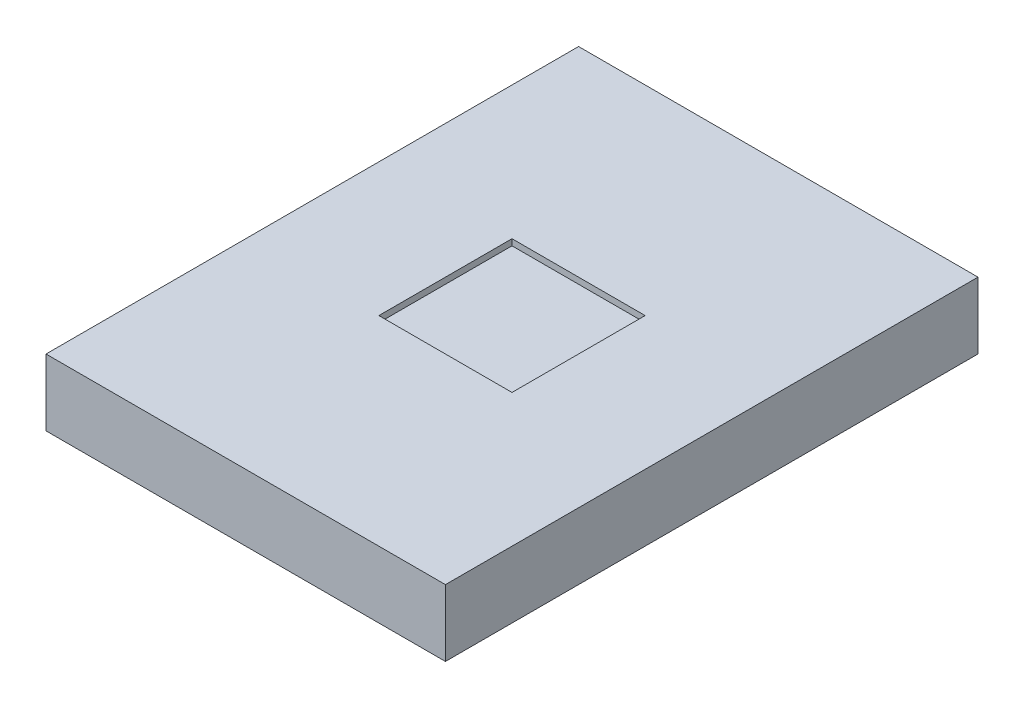
from build123d import *

# Parameters (mm, degrees)
SKETCH1_W           = 30
SKETCH1_H           = 40
BOSS_EXTRUDE1_DEPTH = 5
SKETCH2_W           = 10
SKETCH2_H           = 10
CUT_EXTRUDE1_DEPTH  = 0.465


with BuildPart() as part:
    # Sketch1 → Boss-Extrude1 (new body)
    with BuildSketch(Plane(origin=(0, 0, 0), x_dir=(1, 0, 0), z_dir=(0, 1, 0))):
        with Locations((-1.009379029, 0.27528519)):
            Rectangle(SKETCH1_W, SKETCH1_H)
    extrude(amount=BOSS_EXTRUDE1_DEPTH)

    # Sketch2 → Cut-Extrude1 (cut)
    with BuildSketch(Plane(origin=(0, 5, 0), x_dir=(1, 0, 0), z_dir=(0, 1, 0))):
        with Locations((-1.009379029, 0.27528519)):
            Rectangle(SKETCH2_W, SKETCH2_H)
    extrude(amount=-CUT_EXTRUDE1_DEPTH, mode=Mode.SUBTRACT)


solid = part.part
